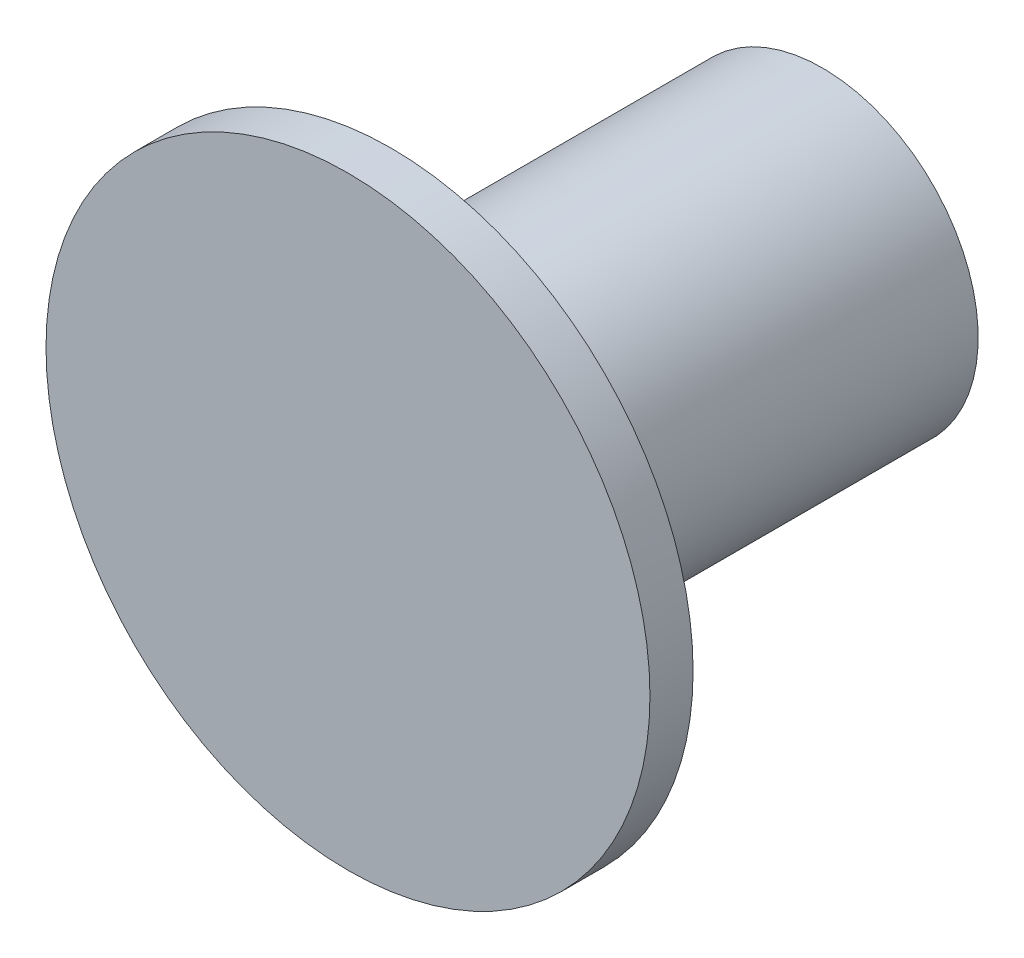
from build123d import *

# Parameters (mm, degrees)
SKETCH1_R           = 1.778
BOSS_EXTRUDE1_DEPTH = 6.35
SKETCH5_R           = 1.778
SKETCH5_R_2         = 0.916592799
CUT_EXTRUDE3_DEPTH  = 6.096
SKETCH6_R           = 0.916592799
CUT_EXTRUDE4_DEPTH  = 3.556


with BuildPart() as part:
    # Sketch1 → Boss-Extrude1 (new body)
    with BuildSketch(Plane.XY):
        Circle(SKETCH1_R)
    extrude(amount=BOSS_EXTRUDE1_DEPTH)

    # Sketch5 → Cut-Extrude3 (cut)
    with BuildSketch(Plane(origin=(0, 0, 0), x_dir=(-1, 0, 0), z_dir=(0, 0, -1))):
        Circle(SKETCH5_R)
        Circle(SKETCH5_R_2, mode=Mode.SUBTRACT)
    extrude(amount=-CUT_EXTRUDE3_DEPTH, mode=Mode.SUBTRACT)

    # Sketch6 → Cut-Extrude4 (cut)
    with BuildSketch(Plane(origin=(0, 0, 0), x_dir=(-1, 0, 0), z_dir=(0, 0, -1))):
        Circle(SKETCH6_R)
    extrude(amount=-CUT_EXTRUDE4_DEPTH, mode=Mode.SUBTRACT)


solid = part.part
